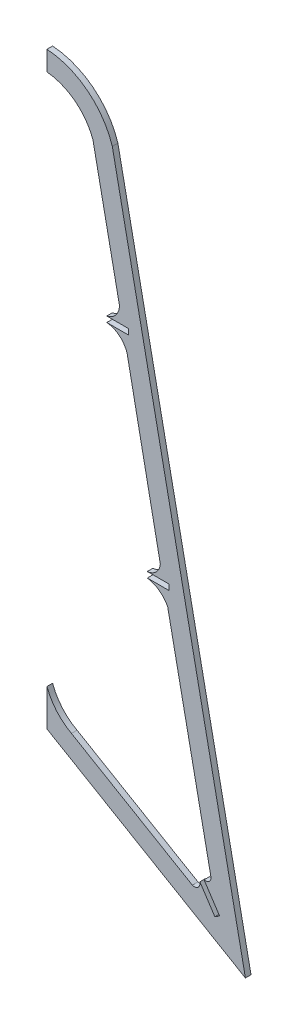
from build123d import *

# Parameters (mm, degrees)
EXTRUDE_1_DEPTH = 2


with BuildPart() as part:
    # Model → 凸台-拉伸1 (new body)
    with BuildSketch(Plane.XY):
        with BuildLine():
            Line((-97.011702464, 42.464925797), (-144.463489001, 275.476643049))
            ThreePointArc((-144.463489001, 275.476643049), (-153.281496848, 288.227053848), (-167.743625943, 293.810696025))
            Line((-167.743625943, 293.810696025), (-167.745826906, 286.787604353))
            ThreePointArc((-167.745826906, 286.787604353), (-157.689004232, 282.787697452), (-151.354655659, 274.011880359))
            Line((-151.354655659, 274.011880359), (-141.897210514, 227.57115189))
            ThreePointArc((-141.897210514, 227.57115189), (-143.213550528, 224.051355827), (-146.432560896, 222.112364438))
            Line((-146.432560896, 222.112364438), (-138.679952298, 222.112364438))
            Line((-138.679952298, 222.112364438), (-138.679952298, 220.112364438))
            Line((-138.679952298, 220.112364438), (-146.432560896, 220.112364438))
            ThreePointArc((-146.432560896, 220.112364438), (-141.8960614, 218.254319099), (-139.170128432, 214.179831448))
            Line((-139.170128432, 214.179831448), (-127.347591585, 155.11105785))
            ThreePointArc((-127.347591585, 155.11105785), (-128.81680318, 151.936000766), (-131.991729699, 150.466507045))
            Line((-131.991729699, 150.466507045), (-124.202532501, 150.465561187))
            Line((-124.202532501, 150.465561187), (-124.202532501, 148.465561187))
            Line((-124.202532501, 148.465561187), (-131.975142876, 148.465561187))
            ThreePointArc((-131.975142876, 148.465561187), (-127.709998786, 146.718869515), (-124.718064663, 143.213057753))
            Line((-124.718064663, 143.213057753), (-109.314139037, 67.572172034))
            ThreePointArc((-109.314139037, 67.572172034), (-109.945142677, 65.832332797), (-111.744040834, 65.397394195))
            Line((-111.744040834, 65.397394195), (-106.221436179, 57.026239152))
            Line((-106.221436179, 57.026239152), (-107.888289044, 55.920988197))
            Line((-107.888289044, 55.920988197), (-113.250526418, 64.049079845))
            ThreePointArc((-113.250526418, 64.049079845), (-113.869929217, 62.064275394), (-115.91101166, 61.66792833))
            Line((-115.91101166, 61.66792833), (-159.023635769, 86.960168667))
            ThreePointArc((-159.023635769, 86.960168667), (-164.320624855, 91.228378401), (-167.743625943, 97.107049276))
            Line((-167.743625943, 97.107049276), (-167.743625943, 83.960168667))
            Line((-167.743625943, 83.960168667), (-97.011702464, 42.464925797))
        make_face()
    extrude(amount=EXTRUDE_1_DEPTH)


solid = part.part
